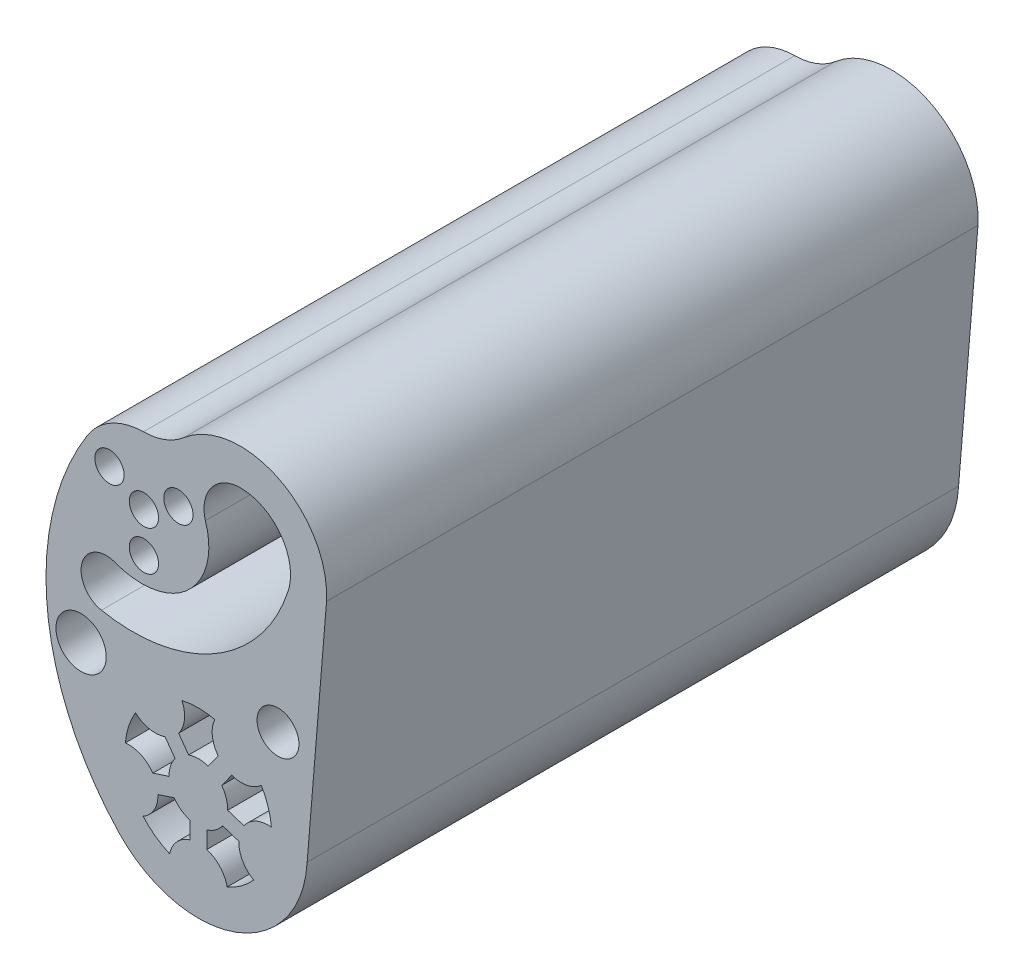
from build123d import *

# Parameters (mm, degrees)
SKETCH_1_R      = 12
SKETCH_1_R_2    = 10
SKETCH_1_R_3    = 7
EXTRUDE_1_DEPTH = 311


with BuildPart() as part:
    # Эскиз1 → Бобышка-Вытянуть1 (new body)
    with BuildSketch(Plane.XY):
        with BuildLine():
            ThreePointArc((-37.98749513, -35.509860796), (17.746819787, -48.877913084), (51.920988797, -2.865470704))
            Line((51.920988797, -2.865470704), (61.180982268, 109.607242119))
            ThreePointArc((61.180982268, 109.607242119), (38.277381578, 148.980209754), (-6.912328256, 143.262200477))
            ThreePointArc((-6.912328256, 143.262200477), (-15.936398986, 137.913716983), (-26.250179642, 135.999022019))
            ThreePointArc((-26.250179642, 135.999022019), (-41.620493207, 131.928483524), (-53.134256146, 120.962669112))
            ThreePointArc((-53.134256146, 120.962669112), (-72.149102751, 40.15262637), (-37.98749513, -35.509860796))
        make_face()
        with BuildLine():
            ThreePointArc((-11.523694148, -7.950124099), (-8.228993532, -11.326237921), (-4, -13.416407865))
            Line((-4, -13.416407865), (-4, -21.583592135))
            ThreePointArc((-4, -21.583592135), (-10.327212311, -25.547556618), (-13.71714256, -32.2))
            ThreePointArc((-13.71714256, -32.2), (-20.57248383, -28.315594803), (-26.38518966, -22.996125035))
            ThreePointArc((-26.38518966, -22.996125035), (-21.105886088, -17.716391723), (-19.291147968, -10.473922835))
            Line((-19.291147968, -10.473922835), (-11.523694148, -7.950124099))
        make_face(mode=Mode.SUBTRACT)
        with Locations((-56, 34)):
            Circle(SKETCH_1_R, mode=Mode.SUBTRACT)
        with BuildLine():
            ThreePointArc((-11.122034659, 8.502960957), (-13.314791228, 4.326237921), (-13.995830103, -0.341671969))
            Line((-13.995830103, -0.341671969), (-21.763283923, -2.865470704))
            ThreePointArc((-21.763283923, -2.865470704), (-27.488454305, 1.927133403), (-34.86284999, 3.095430597))
            ThreePointArc((-34.86284999, 3.095430597), (-33.28697807, 10.815594803), (-30.024086569, 17.987613119))
            ThreePointArc((-30.024086569, 17.987613119), (-23.371367276, 14.598224375), (-15.922585126, 15.110351828))
            Line((-15.922585126, 15.110351828), (-11.122034659, 8.502960957))
        make_face(mode=Mode.SUBTRACT)
        with BuildLine():
            Line((4, -21.583592135), (4, -13.416407865))
            ThreePointArc((4, -13.416407865), (8.228993532, -11.326237921), (11.523694148, -7.950124099))
            Line((11.523694148, -7.950124099), (19.291147968, -10.473922835))
            ThreePointArc((19.291147968, -10.473922835), (21.105886088, -17.716391723), (26.38518966, -22.996125035))
            ThreePointArc((26.38518966, -22.996125035), (20.57248383, -28.315594803), (13.71714256, -32.2))
            ThreePointArc((13.71714256, -32.2), (10.327212311, -25.547556618), (4, -21.583592135))
        make_face(mode=Mode.SUBTRACT)
        with BuildLine():
            ThreePointArc((4.649898704, 13.205242975), (0, 14), (-4.649898704, 13.205242975))
            Line((-4.649898704, 13.205242975), (-9.450449171, 19.812633846))
            ThreePointArc((-9.450449171, 19.812633846), (-6.661586748, 26.738590562), (-7.829283679, 34.113081319))
            ThreePointArc((-7.829283679, 34.113081319), (0, 35), (7.829283679, 34.113081319))
            ThreePointArc((7.829283679, 34.113081319), (6.661586748, 26.738590562), (9.450449171, 19.812633846))
            Line((9.450449171, 19.812633846), (4.649898704, 13.205242975))
        make_face(mode=Mode.SUBTRACT)
        with BuildLine():
            ThreePointArc((13.995830103, -0.341671969), (13.314791228, 4.326237921), (11.122034659, 8.502960957))
            Line((11.122034659, 8.502960957), (15.922585126, 15.110351828))
            ThreePointArc((15.922585126, 15.110351828), (23.371367276, 14.598224375), (30.024086569, 17.987613119))
            ThreePointArc((30.024086569, 17.987613119), (33.28697807, 10.815594803), (34.86284999, 3.095430597))
            ThreePointArc((34.86284999, 3.095430597), (27.488454305, 1.927133403), (21.763283923, -2.865470704))
            Line((21.763283923, -2.865470704), (13.995830103, -0.341671969))
        make_face(mode=Mode.SUBTRACT)
        with Locations((38, 44)):
            Circle(SKETCH_1_R_2, mode=Mode.SUBTRACT)
        with Locations((-26, 85)):
            Circle(SKETCH_1_R_3, mode=Mode.SUBTRACT)
        with BuildLine():
            ThreePointArc((-39.719957497, 75.210764299), (-29.341451826, 72.9489184), (-18.758284903, 73.857711393))
            ThreePointArc((-18.758284903, 73.857711393), (1.170574134, 89.074856744), (3.323461498, 114.056570279))
            ThreePointArc((3.323461498, 114.056570279), (6.219388218, 129.16434937), (20, 136))
            ThreePointArc((20, 136), (39.428131569, 126.090695644), (42.812990739, 104.545641977))
            ThreePointArc((42.812990739, 104.545641977), (8.162699165, 61.508737426), (-46.303776516, 52.223217173))
            ThreePointArc((-46.303776516, 52.223217173), (-55.536170835, 67.30405243), (-39.719957497, 75.210764299))
        make_face(mode=Mode.SUBTRACT)
        with Locations((-42.454482672, 113.5)):
            Circle(SKETCH_1_R_3, mode=Mode.SUBTRACT)
        with Locations((-26, 104)):
            Circle(SKETCH_1_R_3, mode=Mode.SUBTRACT)
        with Locations((-9.545517328, 113.5)):
            Circle(SKETCH_1_R_3, mode=Mode.SUBTRACT)
    extrude(amount=EXTRUDE_1_DEPTH)


solid = part.part
